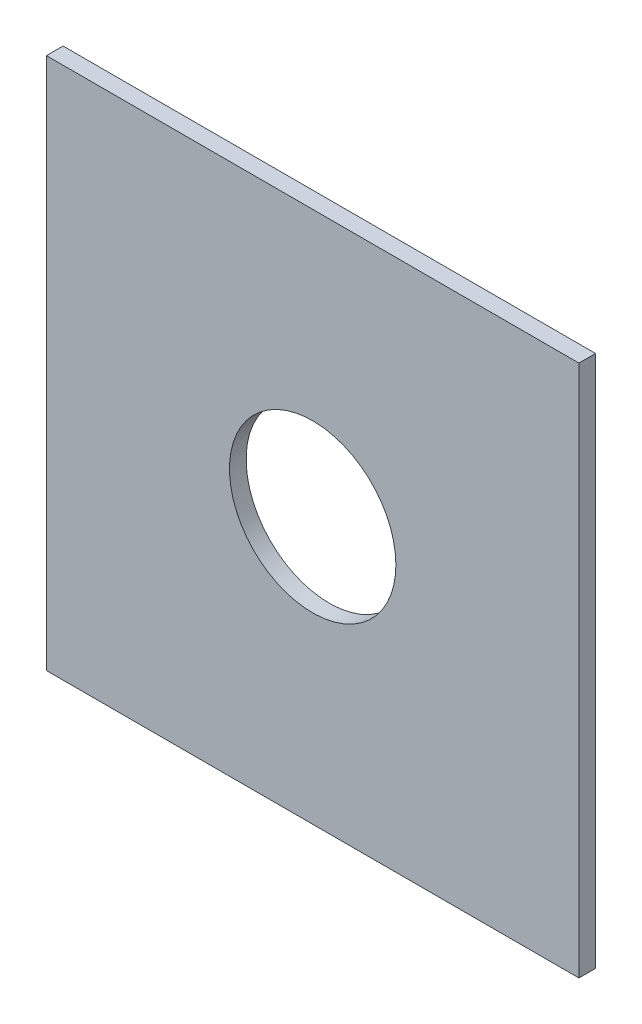
from build123d import *

# Parameters (mm, degrees)
CROQUIS1_W              = 160
CROQUIS1_H              = 160
SALIENTE_EXTRUIR1_DEPTH = 5
CROQUIS2_R              = 25
CORTAR_EXTRUIR1_DEPTH   = 10


with BuildPart() as part:
    # Croquis1 → Saliente-Extruir1 (new body)
    with BuildSketch(Plane.XY):
        Rectangle(CROQUIS1_W, CROQUIS1_H)
    extrude(amount=SALIENTE_EXTRUIR1_DEPTH)

    # Croquis2 → Cortar-Extruir1 (cut)
    with BuildSketch(Plane.XY.offset(5)):
        Circle(CROQUIS2_R)
    extrude(amount=-CORTAR_EXTRUIR1_DEPTH, mode=Mode.SUBTRACT)


solid = part.part
